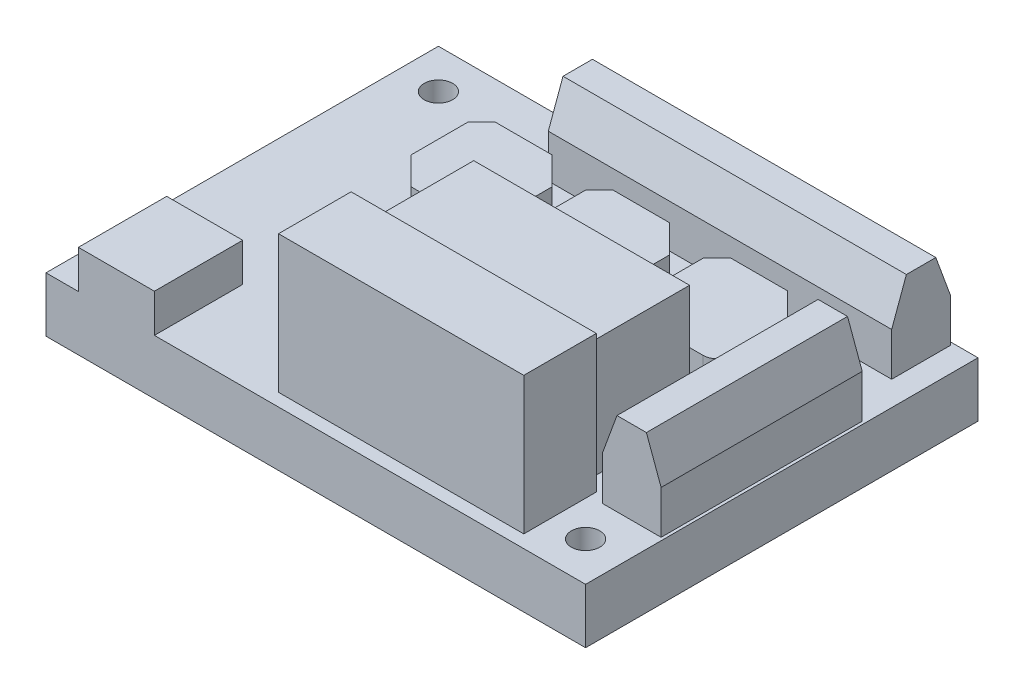
from build123d import *

# Parameters (mm, degrees)
SKETCH1_W              = 55
SKETCH1_H              = 40
BOSS_EXTRUDE1_DEPTH    = 5.6
M2_5_CLEARANCE_HOLE1_D = 2.9
SKETCH5_W              = 25
SKETCH5_H              = 7.4
BOSS_EXTRUDE2_DEPTH    = 14
SKETCH6_W              = 6
SKETCH6_H              = 20.5
BOSS_EXTRUDE3_DEPTH    = 8.5
CUT_EXTRUDE1_REACH     = 48.523
SKETCH8_W              = 35
SKETCH8_H              = 6
BOSS_EXTRUDE4_DEPTH    = 8.5
CUT_EXTRUDE2_REACH     = 61.501
SKETCH10_W             = 22
SKETCH10_H             = 9.5
BOSS_EXTRUDE5_DEPTH    = 12
BOSS_EXTRUDE6_DEPTH    = 4.5
LPATTERN1_COUNT        = 3
LPATTERN1_PITCH        = 12
SKETCH12_W             = 7.75
SKETCH12_H             = 9
BOSS_EXTRUDE7_DEPTH    = 3.9


with BuildPart() as part:
    # Sketch1 → Boss-Extrude1 (new body)
    with BuildSketch(Plane(origin=(0, 0, 0), x_dir=(1, 0, 0), z_dir=(0, 1, 0))):
        Rectangle(SKETCH1_W, SKETCH1_H)
    extrude(amount=BOSS_EXTRUDE1_DEPTH)

    # M2.5 Clearance Hole1 (through all)
    with Locations(Plane(origin=(0, 5.6, 0), x_dir=(-1, 0, 0), z_dir=(0, 1, 0))):
        with Locations((23.5, -16), (-23.5, 16)):
            Hole(M2_5_CLEARANCE_HOLE1_D / 2)

    # Sketch5 → Boss-Extrude2 (add)
    with BuildSketch(Plane(origin=(0, 5.6, 0), x_dir=(1, 0, 0), z_dir=(0, 1, 0))):
        with Locations((7.4, -15)):
            Rectangle(SKETCH5_W, SKETCH5_H)
    extrude(amount=BOSS_EXTRUDE2_DEPTH)

    # Sketch6 → Boss-Extrude3 (add)
    with BuildSketch(Plane(origin=(0, 5.6, 0), x_dir=(1, 0, 0), z_dir=(0, 1, 0))):
        with Locations((24.2, -1.75)):
            Rectangle(SKETCH6_W, SKETCH6_H)
    extrude(amount=BOSS_EXTRUDE3_DEPTH)

    # Sketch7 → Cut-Extrude1 (cut, up to next)
    with BuildSketch(Plane.XY.offset(12), mode=Mode.PRIVATE) as cut_extrude1_sk1:
        Polygon((25.7, 14.1), (27.2, 10), (27.2, 14.1), align=None)
    cut_extrude1_tool1 = extrude(cut_extrude1_sk1.sketch, amount=-CUT_EXTRUDE1_REACH, mode=Mode.PRIVATE) & part.part
    # Sketch7 → Cut-Extrude1 (cut, up to next)
    with BuildSketch(Plane.XY.offset(12), mode=Mode.PRIVATE) as cut_extrude1_sk2:
        Polygon((22.7, 14.1), (21.2, 10), (21.2, 14.1), align=None)
    cut_extrude1_tool2 = extrude(cut_extrude1_sk2.sketch, amount=-CUT_EXTRUDE1_REACH, mode=Mode.PRIVATE) & part.part
    add(cut_extrude1_tool1.solids().sort_by_distance((26.7, 12.733333, 12))[0], mode=Mode.SUBTRACT)
    add(cut_extrude1_tool2.solids().sort_by_distance((21.7, 12.733333, 12))[0], mode=Mode.SUBTRACT)

    # Sketch8 → Boss-Extrude4 (add)
    with BuildSketch(Plane(origin=(0, 5.6, 0), x_dir=(-1, 0, 0), z_dir=(0, 1, 0))):
        with Locations((-7.5, -16.7)):
            Rectangle(SKETCH8_W, SKETCH8_H)
    extrude(amount=BOSS_EXTRUDE4_DEPTH)

    # Sketch9 → Cut-Extrude2 (cut, up to next)
    with BuildSketch(Plane(origin=(25, 0, 0), x_dir=(0, 0, -1), z_dir=(1, 0, 0)), mode=Mode.PRIVATE) as cut_extrude2_sk1:
        Polygon((18.2, 14.1), (19.7, 10), (19.7, 14.1), align=None)
    cut_extrude2_tool1 = extrude(cut_extrude2_sk1.sketch, amount=-CUT_EXTRUDE2_REACH, mode=Mode.PRIVATE) & part.part
    # Sketch9 → Cut-Extrude2 (cut, up to next)
    with BuildSketch(Plane(origin=(25, 0, 0), x_dir=(0, 0, -1), z_dir=(1, 0, 0)), mode=Mode.PRIVATE) as cut_extrude2_sk2:
        Polygon((15.2, 14.1), (13.7, 10), (13.7, 14.1), align=None)
    cut_extrude2_tool2 = extrude(cut_extrude2_sk2.sketch, amount=-CUT_EXTRUDE2_REACH, mode=Mode.PRIVATE) & part.part
    add(cut_extrude2_tool1.solids().sort_by_distance((25, 12.733333, -19.2))[0], mode=Mode.SUBTRACT)
    add(cut_extrude2_tool2.solids().sort_by_distance((25, 12.733333, -14.2))[0], mode=Mode.SUBTRACT)

    # Sketch10 → Boss-Extrude5 (add)
    with BuildSketch(Plane(origin=(0, 5.6, 0), x_dir=(1, 0, 0), z_dir=(0, 1, 0))):
        with Locations((7.4, -5.05)):
            Rectangle(SKETCH10_W, SKETCH10_H)
    extrude(amount=BOSS_EXTRUDE5_DEPTH)

    # Sketch11 → Boss-Extrude6 (add)
    with BuildSketch(Plane(origin=(0, 5.6, 0), x_dir=(-1, 0, 0), z_dir=(0, 1, 0))):
        with BuildLine():
            Line((-19.2, -3.114213562), (-19.2, -8.871572875))
            Line((-19.2, -8.871572875), (-16.371572875, -11.7))
            Line((-16.371572875, -11.7), (-10.614213562, -11.7))
            Line((-10.614213562, -11.7), (-9.2, -10.285786438))
            Line((-9.2, -10.285786438), (-9.2, -4.528427125))
            Line((-9.2, -4.528427125), (-12.028427125, -1.7))
            Line((-12.028427125, -1.7), (-17.785786438, -1.7))
            ThreePointArc((-17.785786438, -1.7), (-18.785786438, -2.114213562), (-19.2, -3.114213562))
        make_face()
    boss_extrude6 = extrude(amount=BOSS_EXTRUDE6_DEPTH)

    # LPattern1: Boss-Extrude6 ×3
    with Locations(*[(-i * LPATTERN1_PITCH, 0, 0) for i in range(1, LPATTERN1_COUNT)]):
        add(boss_extrude6)

    # Sketch12 → Boss-Extrude7 (add)
    with BuildSketch(Plane(origin=(0, 5.6, 0), x_dir=(-1, 0, 0), z_dir=(0, 1, 0))):
        with Locations((20.325, 15.5)):
            Rectangle(SKETCH12_W, SKETCH12_H)
    extrude(amount=BOSS_EXTRUDE7_DEPTH)


solid = part.part
